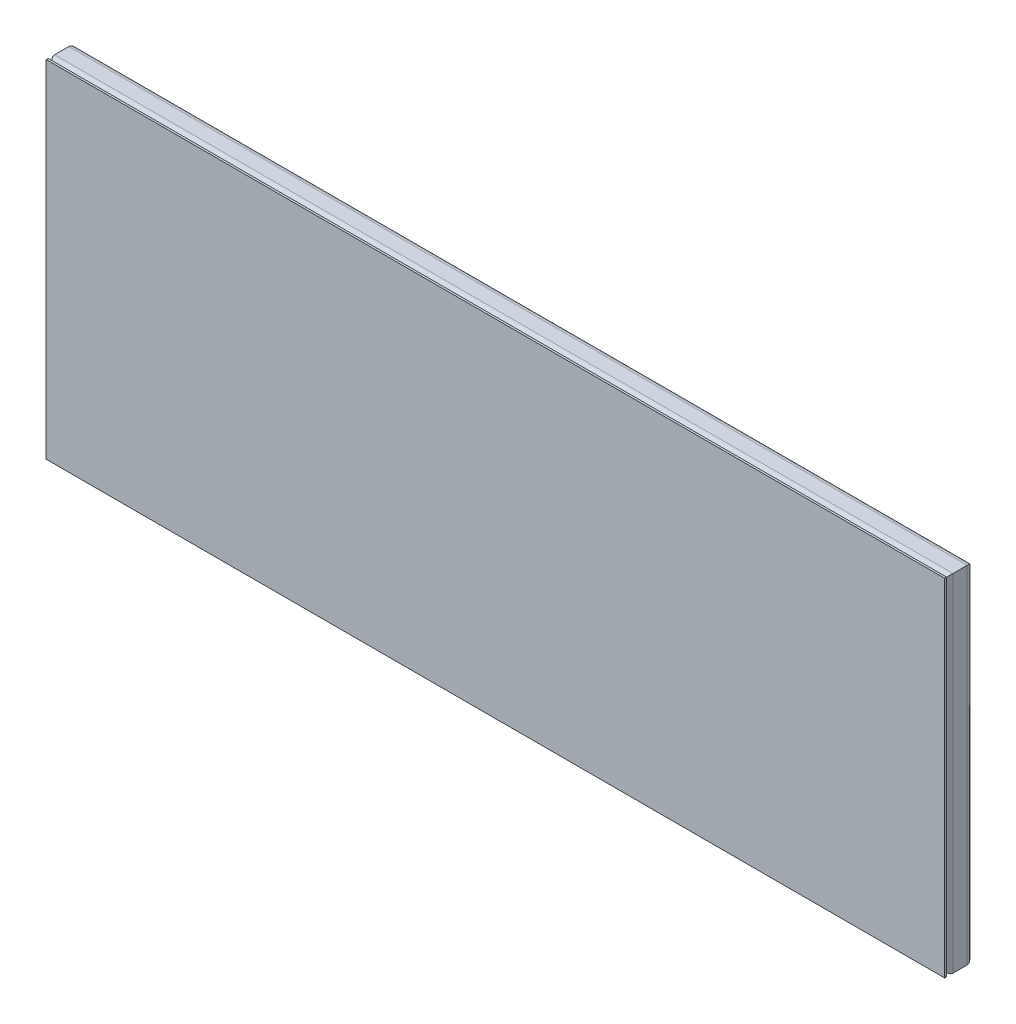
from build123d import *

# Parameters (mm, degrees)
TUBO_CUADRADO_2_X_2_X_0_25_1_DEPTH      = 313.921024484
TUBO_CUADRADO_2_X_2_X_0_25_1_DEPTH_BACK = 36.921024484
TUBO_CUADRADO_2_X_2_X_0_25_1_2_DEPTH    = 873.842048969
TUBO_CUADRADO_2_X_2_X_0_25_1_3_DEPTH    = 350.842048969
TUBO_CUADRADO_2_X_2_X_0_25_1_4_DEPTH    = 873.842048969
CROQUIS3_W                              = 850.8
CROQUIS3_H                              = 327.8
SALIENTE_EXTRUIR1_DEPTH                 = 1.9


with BuildPart() as part:
    # Sketch1 → Tubo cuadrado 2 X 2 X 0.25(1) (new, two sides: drawn at the far end of the back side and taken through both)
    with BuildSketch(Plane(origin=(-412.7, 138.5, 12.7), x_dir=(1, 0, 0), z_dir=(0, -1, 0)).offset(-TUBO_CUADRADO_2_X_2_X_0_25_1_DEPTH_BACK)):
        with BuildLine():
            Line((-6.7, -12.7), (6.7, -12.7))
            ThreePointArc((6.7, -12.7), (10.942640687, -10.942640687), (12.7, -6.7))
            Line((12.7, -6.7), (12.7, 6.7))
            ThreePointArc((12.7, 6.7), (10.942640687, 10.942640687), (6.7, 12.7))
            Line((6.7, 12.7), (-6.7, 12.7))
            ThreePointArc((-6.7, 12.7), (-10.942640687, 10.942640687), (-12.7, 6.7))
            Line((-12.7, 6.7), (-12.7, -6.7))
            ThreePointArc((-12.7, -6.7), (-10.942640687, -10.942640687), (-6.7, -12.7))
        make_face()
        with BuildLine():
            Line((-6.7, -9.7), (6.7, -9.7))
            ThreePointArc((6.7, -9.7), (8.821320344, -8.821320344), (9.7, -6.7))
            Line((9.7, -6.7), (9.7, 6.7))
            ThreePointArc((9.7, 6.7), (8.821320344, 8.821320344), (6.7, 9.7))
            Line((6.7, 9.7), (-6.7, 9.7))
            ThreePointArc((-6.7, 9.7), (-8.821320344, 8.821320344), (-9.7, 6.7))
            Line((-9.7, 6.7), (-9.7, -6.7))
            ThreePointArc((-9.7, -6.7), (-8.821320344, -8.821320344), (-6.7, -9.7))
        make_face(mode=Mode.SUBTRACT)
    extrude(amount=TUBO_CUADRADO_2_X_2_X_0_25_1_DEPTH + TUBO_CUADRADO_2_X_2_X_0_25_1_DEPTH_BACK)

    # Tubo cuadrado 2 X 2 X 0.25(1) mitre 1
    split(bisect_by=Plane(origin=(-400, 138.5, 0), x_dir=(0.707106781, -0.707106781, 0), z_dir=(-0.707106781, -0.707106781, 0)), keep=Keep.TOP)

    # Tubo cuadrado 2 X 2 X 0.25(1) mitre 2
    split(bisect_by=Plane(origin=(-400, -138.5, 0), x_dir=(-0.707106781, -0.707106781, 0), z_dir=(-0.707106781, 0.707106781, 0)), keep=Keep.TOP)


with BuildPart() as body_2:
    # Sketch1 on segment 2 (carried to segment 2) → Tubo cuadrado 2 X 2 X 0.25_1 2 (new body)
    with BuildSketch(Plane(origin=(-436.921024484, -151.2, 12.7), x_dir=(0, 1, 0), z_dir=(1, 0, 0))):
        with BuildLine():
            Line((-6.7, -12.7), (6.7, -12.7))
            ThreePointArc((6.7, -12.7), (10.942640687, -10.942640687), (12.7, -6.7))
            Line((12.7, -6.7), (12.7, 6.7))
            ThreePointArc((12.7, 6.7), (10.942640687, 10.942640687), (6.7, 12.7))
            Line((6.7, 12.7), (-6.7, 12.7))
            ThreePointArc((-6.7, 12.7), (-10.942640687, 10.942640687), (-12.7, 6.7))
            Line((-12.7, 6.7), (-12.7, -6.7))
            ThreePointArc((-12.7, -6.7), (-10.942640687, -10.942640687), (-6.7, -12.7))
        make_face()
        with BuildLine():
            Line((-6.7, -9.7), (6.7, -9.7))
            ThreePointArc((6.7, -9.7), (8.821320344, -8.821320344), (9.7, -6.7))
            Line((9.7, -6.7), (9.7, 6.7))
            ThreePointArc((9.7, 6.7), (8.821320344, 8.821320344), (6.7, 9.7))
            Line((6.7, 9.7), (-6.7, 9.7))
            ThreePointArc((-6.7, 9.7), (-8.821320344, 8.821320344), (-9.7, 6.7))
            Line((-9.7, 6.7), (-9.7, -6.7))
            ThreePointArc((-9.7, -6.7), (-8.821320344, -8.821320344), (-6.7, -9.7))
        make_face(mode=Mode.SUBTRACT)
    extrude(amount=TUBO_CUADRADO_2_X_2_X_0_25_1_2_DEPTH)

    # Tubo cuadrado 2 X 2 X 0.25_1 2 mitre 1
    split(bisect_by=Plane(origin=(-400, -138.5, 0), x_dir=(0.707106781, 0.707106781, 0), z_dir=(0.707106781, -0.707106781, 0)), keep=Keep.TOP)

    # Tubo cuadrado 2 X 2 X 0.25_1 2 mitre 2
    split(bisect_by=Plane(origin=(400, -138.5, 0), x_dir=(0.707106781, -0.707106781, 0), z_dir=(-0.707106781, -0.707106781, 0)), keep=Keep.TOP)


with BuildPart() as body_3:
    # Sketch1 on segment 3 (carried to segment 3) → Tubo cuadrado 2 X 2 X 0.25_1 3 (new body)
    with BuildSketch(Plane(origin=(412.7, -175.421024484, 12.7), x_dir=(-1, 0, 0), z_dir=(0, 1, 0))):
        with BuildLine():
            Line((-6.7, -12.7), (6.7, -12.7))
            ThreePointArc((6.7, -12.7), (10.942640687, -10.942640687), (12.7, -6.7))
            Line((12.7, -6.7), (12.7, 6.7))
            ThreePointArc((12.7, 6.7), (10.942640687, 10.942640687), (6.7, 12.7))
            Line((6.7, 12.7), (-6.7, 12.7))
            ThreePointArc((-6.7, 12.7), (-10.942640687, 10.942640687), (-12.7, 6.7))
            Line((-12.7, 6.7), (-12.7, -6.7))
            ThreePointArc((-12.7, -6.7), (-10.942640687, -10.942640687), (-6.7, -12.7))
        make_face()
        with BuildLine():
            Line((-6.7, -9.7), (6.7, -9.7))
            ThreePointArc((6.7, -9.7), (8.821320344, -8.821320344), (9.7, -6.7))
            Line((9.7, -6.7), (9.7, 6.7))
            ThreePointArc((9.7, 6.7), (8.821320344, 8.821320344), (6.7, 9.7))
            Line((6.7, 9.7), (-6.7, 9.7))
            ThreePointArc((-6.7, 9.7), (-8.821320344, 8.821320344), (-9.7, 6.7))
            Line((-9.7, 6.7), (-9.7, -6.7))
            ThreePointArc((-9.7, -6.7), (-8.821320344, -8.821320344), (-6.7, -9.7))
        make_face(mode=Mode.SUBTRACT)
    extrude(amount=TUBO_CUADRADO_2_X_2_X_0_25_1_3_DEPTH)

    # Tubo cuadrado 2 X 2 X 0.25_1 3 mitre 1
    split(bisect_by=Plane(origin=(400, 138.5, 0), x_dir=(0.707106781, 0.707106781, 0), z_dir=(0.707106781, -0.707106781, 0)), keep=Keep.TOP)

    # Tubo cuadrado 2 X 2 X 0.25_1 3 mitre 2
    split(bisect_by=Plane(origin=(400, -138.5, 0), x_dir=(-0.707106781, 0.707106781, 0), z_dir=(0.707106781, 0.707106781, 0)), keep=Keep.TOP)


with BuildPart() as body_4:
    # Sketch1 on segment 4 (carried to segment 4) → Tubo cuadrado 2 X 2 X 0.25_1 4 (new body)
    with BuildSketch(Plane(origin=(436.921024484, 151.2, 12.7), x_dir=(0, -1, 0), z_dir=(-1, 0, 0))):
        with BuildLine():
            Line((-6.7, -12.7), (6.7, -12.7))
            ThreePointArc((6.7, -12.7), (10.942640687, -10.942640687), (12.7, -6.7))
            Line((12.7, -6.7), (12.7, 6.7))
            ThreePointArc((12.7, 6.7), (10.942640687, 10.942640687), (6.7, 12.7))
            Line((6.7, 12.7), (-6.7, 12.7))
            ThreePointArc((-6.7, 12.7), (-10.942640687, 10.942640687), (-12.7, 6.7))
            Line((-12.7, 6.7), (-12.7, -6.7))
            ThreePointArc((-12.7, -6.7), (-10.942640687, -10.942640687), (-6.7, -12.7))
        make_face()
        with BuildLine():
            Line((-6.7, -9.7), (6.7, -9.7))
            ThreePointArc((6.7, -9.7), (8.821320344, -8.821320344), (9.7, -6.7))
            Line((9.7, -6.7), (9.7, 6.7))
            ThreePointArc((9.7, 6.7), (8.821320344, 8.821320344), (6.7, 9.7))
            Line((6.7, 9.7), (-6.7, 9.7))
            ThreePointArc((-6.7, 9.7), (-8.821320344, 8.821320344), (-9.7, 6.7))
            Line((-9.7, 6.7), (-9.7, -6.7))
            ThreePointArc((-9.7, -6.7), (-8.821320344, -8.821320344), (-6.7, -9.7))
        make_face(mode=Mode.SUBTRACT)
    extrude(amount=TUBO_CUADRADO_2_X_2_X_0_25_1_4_DEPTH)

    # Tubo cuadrado 2 X 2 X 0.25_1 4 mitre 1
    split(bisect_by=Plane(origin=(-400, 138.5, 0), x_dir=(-0.707106781, 0.707106781, 0), z_dir=(0.707106781, 0.707106781, 0)), keep=Keep.TOP)

    # Tubo cuadrado 2 X 2 X 0.25_1 4 mitre 2
    split(bisect_by=Plane(origin=(400, 138.5, 0), x_dir=(-0.707106781, -0.707106781, 0), z_dir=(-0.707106781, 0.707106781, 0)), keep=Keep.TOP)


with BuildPart() as body_5:
    # Croquis3 → Saliente-Extruir1 (new body)
    with BuildSketch(Plane.XY.offset(25.4)):
        Rectangle(CROQUIS3_W, CROQUIS3_H)
    extrude(amount=SALIENTE_EXTRUIR1_DEPTH)


solid = Compound([part.part, body_2.part, body_3.part, body_4.part, body_5.part])
